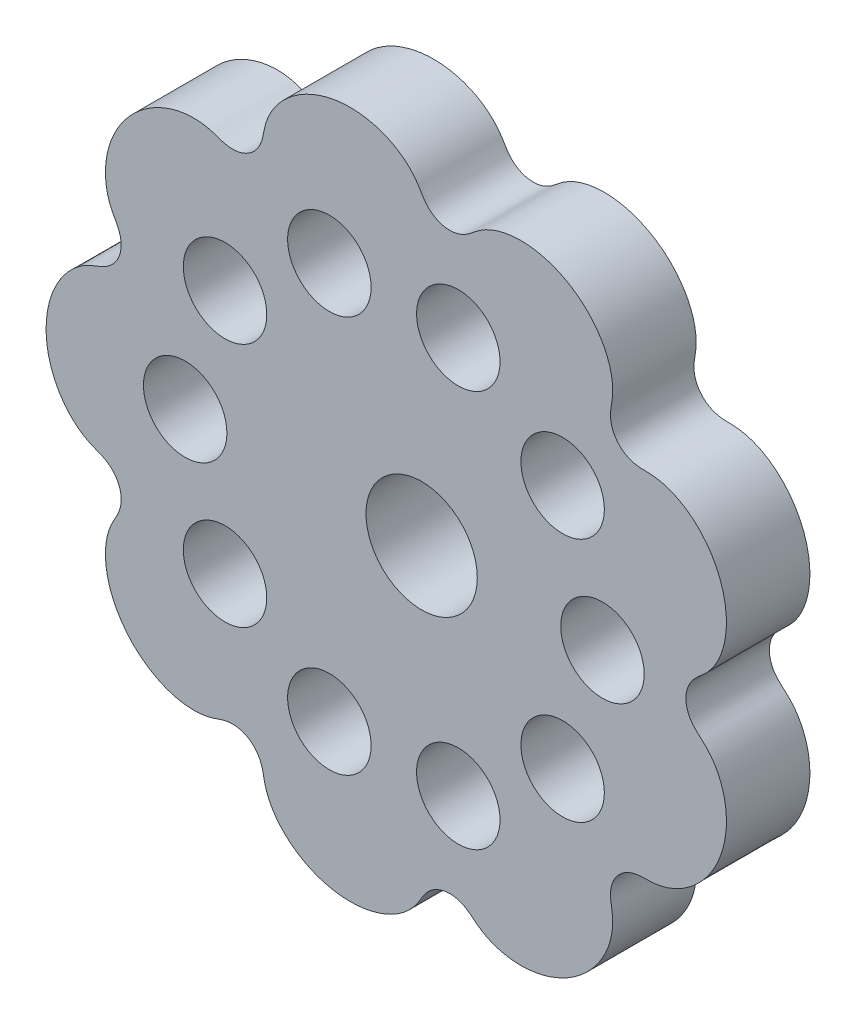
from build123d import *

# Parameters (mm, degrees)
BOSS_EXTRUDE2_DEPTH     = 6
CUT_EXTRUDE1_DEPTH      = 36.670587031
CUT_EXTRUDE1_DEPTH_BACK = 36.670587031
SKETCH6_R               = 4
CUT_EXTRUDE2_DEPTH      = 36.670587031
CUT_EXTRUDE2_DEPTH_BACK = 36.670587031
SKETCH7_R               = 3


with BuildPart() as part:
    # Sketch5 → Boss-Extrude2 (new body)
    with BuildSketch(Plane.XY):
        with BuildLine():
            add(Edge.make_bspline(
                [(21, 0), (21, 0.153716287), (21.031368682, 0.443660206), (21.153926718, 0.826861065), (21.307471228, 1.123621196), (21.458168044, 1.341152827), (21.591257139, 1.499527161), (21.704506257, 1.617762851), (21.800797031, 1.709847827), (21.884182228, 1.785218707), (21.95839232, 1.850124781), (22.026445031, 1.908757729), (22.090651041, 1.964007282), (22.152729406, 2.017933884), (22.213932781, 2.072059386), (22.275153664, 2.127546476), (22.337007477, 2.185310863), (22.399895555, 2.246092552), (22.464052479, 2.310501913), (22.529581703, 2.379049966), (22.596482605, 2.452168597), (22.664671258, 2.53022427), (22.733996607, 2.613527444), (22.80425328, 2.70233915), (22.875191893, 2.796875644), (22.946527489, 2.897311766), (23.01794658, 3.003783415), (23.089113103, 3.116389433), (23.159673571, 3.235193087), (23.229261566, 3.360223299), (23.297501731, 3.491475708), (23.364013359, 3.628913644), (23.428413646, 3.772469067), (23.490320667, 3.92204349), (23.549356123, 4.077508937), (23.605147883, 4.238708933), (23.657332346, 4.405459549), (23.705556639, 4.577550508), (23.749480676, 4.754746359), (23.788779057, 4.936787725), (23.823142854, 5.123392612), (23.852281244, 5.314257798), (23.875923035, 5.509060288), (23.893818051, 5.707458827), (23.905738396, 5.909095486), (23.91147959, 6.113597299), (23.910861585, 6.32057795), (23.903729646, 6.529639508), (23.889955112, 6.740374204), (23.869436024, 6.952366241), (23.842097627, 7.165193627), (23.807892744, 7.378430031), (23.766802021, 7.591646653), (23.718834045, 7.804414097), (23.664025333, 8.016304242), (23.602440191, 8.226892105), (23.534170455, 8.435757687), (23.459335103, 8.642487793), (23.378079742, 8.846677819), (23.290575984, 9.047933508), (23.197020693, 9.245872649), (23.097635128, 9.440126729), (22.992663969, 9.630342523), (22.882374239, 9.816183615), (22.767054117, 9.997331851), (22.647011657, 10.173488706), (22.52257341, 10.344376568), (22.394082954, 10.50973993), (22.261899338, 10.669346484), (22.126395448, 10.822988114), (21.987956291, 10.970481783), (21.846977209, 11.111670303), (21.703862028, 11.246422991), (21.55902114, 11.374636212), (21.412869523, 11.496233783), (21.26582471, 11.611167266), (21.118304697, 11.719416115), (20.970725801, 11.820987698), (20.823500457, 11.915917182), (20.677034967, 12.004267267), (20.531727178, 12.086127792), (20.387964097, 12.161615176), (20.246119415, 12.230871724), (20.106550937, 12.294064768), (19.969597882, 12.351385648), (19.835578028, 12.403048534), (19.70478464, 12.449289064), (19.577483136, 12.49036281), (19.453907389, 12.526543549), (19.334255553, 12.558121334), (19.218685256, 12.58540035), (19.107307931, 12.608696544), (19.000181988, 12.628335033), (18.897304398, 12.64464727), (18.798600094, 12.657968004), (18.703908342, 12.668632096), (18.612964856, 12.676971324), (18.525377888, 12.683311466), (18.440595686, 12.68797026), (18.357861433, 12.691257356), (18.276149883, 12.693478506), (18.194077001, 12.694948305), (18.109769679, 12.696020001), (18.020676933, 12.69714923), (17.923298016, 12.699025392), (17.812802941, 12.70283799), (17.682549757, 12.710809757), (17.523632309, 12.727236362), (17.32501124, 12.760377708), (17.075817946, 12.825299178), (16.772834753, 12.945961355), (16.434148387, 13.150161532), (16.107175074, 13.44950624), (15.848656953, 13.816160834), (15.685840243, 14.191204191), (15.605394373, 14.523741279), (15.576984133, 14.794159555), (15.575265987, 15.006710349), (15.585273878, 15.17424955), (15.59961559, 15.309583491), (15.615028262, 15.422865923), (15.630216798, 15.521548159), (15.64474294, 15.610975853), (15.658500392, 15.694984964), (15.671478728, 15.776354613), (15.683662901, 15.857123307), (15.694994965, 15.938803823), (15.705363699, 16.022528679), (15.714606266, 16.109149285), (15.72251458, 16.199304373), (15.728843092, 16.293467903), (15.733316556, 16.391983175), (15.735637213, 16.495087521), (15.735491214, 16.602930509), (15.732554285, 16.715587628), (15.726496706, 16.833070761), (15.716987677, 16.955336404), (15.703699171, 17.082292226), (15.686309336, 17.213802463), (15.664505523, 17.349692438), (15.637986975, 17.489752447), (15.606467229, 17.633741193), (15.569676268, 17.781388861), (15.527362435, 17.932399953), (15.479294136, 18.086455931), (15.425261358, 18.243217727), (15.36507699, 18.402328141), (15.298577989, 18.56341417), (15.225626365, 18.72608928), (15.146110017, 18.88995562), (15.059943415, 19.054606216), (14.967068127, 19.219627114), (14.867453208, 19.384599507), (14.76109544, 19.549101826), (14.648019439, 19.712711797), (14.528277615, 19.875008471), (14.401950015, 20.035574213), (14.269144018, 20.193996651), (14.129993918, 20.34987058), (13.984660371, 20.502799815), (13.833329733, 20.652398988), (13.676213275, 20.798295284), (13.513546287, 20.940130109), (13.345587081, 21.077560691), (13.172615882, 21.210261595), (12.99493363, 21.337926164), (12.812860687, 21.460267861), (12.626735458, 21.577021531), (12.436912931, 21.687944554), (12.243763148, 21.7928179), (12.047669601, 21.891447079), (11.849027573, 21.983662975), (11.648242422, 22.069322576), (11.44572782, 22.148309571), (11.241903949, 22.220534845), (11.03719567, 22.285936836), (10.832030657, 22.344481778), (10.62683752, 22.396163808), (10.422043914, 22.441004952), (10.218074647, 22.479054977), (10.015349781, 22.510391113), (9.814282756, 22.53511765), (9.615278519, 22.553365386), (9.418731679, 22.565290967), (9.225024692, 22.571076068), (9.034526076, 22.570926463), (8.847588665, 22.565070944), (8.664547904, 22.553760111), (8.48572019, 22.537265029), (8.311401257, 22.515875734), (8.14186461, 22.489899605), (7.977360004, 22.459659579), (7.818111962, 22.425492218), (7.664318328, 22.387745593), (7.516148849, 22.346777007), (7.373743756, 22.302950497), (7.237212344, 22.256634119), (7.106631495, 22.208196971), (6.98204413, 22.15800591), (6.8634575, 22.106421889), (6.750841268, 22.053795861), (6.644125244, 22.000464112), (6.543196637, 21.946742896), (6.447896581, 21.892922167), (6.358015659, 21.839258151), (6.273287925, 21.785964407), (6.193382808, 21.733200874), (6.117893894, 21.681060281), (6.04632311, 21.629551), (5.978058059, 21.578575182), (5.912338981, 21.52790057), (5.848209766, 21.477124044), (5.784444076, 21.425624598), (5.719432019, 21.37250387), (5.651003607, 21.316514657), (5.576150569, 21.2559859), (5.490587051, 21.188775678), (5.388068997, 21.112344956), (5.25941126, 21.024195837), (5.091353567, 20.923244125), (4.866266554, 20.813180263), (4.565790839, 20.708632471), (4.183392496, 20.640754922), (3.743664709, 20.649470037), (3.305580683, 20.75419156), (2.930351837, 20.931613487), (2.645031729, 21.134494647), (2.441632936, 21.325944641), (2.29836216, 21.490825669), (2.194914722, 21.628382912), (2.116761135, 21.743416963), (2.054417639, 21.841643819), (2.001812156, 21.928053209), (1.954995439, 22.006573716), (1.9113121, 22.080170839), (1.868900646, 22.151040507), (1.826396557, 22.220790386), (1.782755082, 22.290584135), (1.737144061, 22.361249751), (1.688878057, 22.433359287), (1.637377189, 22.507287326), (1.582141037, 22.583254109), (1.522731872, 22.661357656), (1.458763779, 22.741598027), (1.389895548, 22.823895922), (1.315826016, 22.908107177), (1.236290991, 22.994034277), (1.15106124, 23.081435656), (1.059941153, 23.170033361), (0.96276785, 23.259519482), (0.85941057, 23.349561652), (0.749770218, 23.439807823), (0.633779, 23.529890493), (0.511400083, 23.619430487), (0.38262725, 23.708040394), (0.24748451, 23.795327717), (0.106025655, 23.880897789), (-0.041666263, 23.964356487), (-0.195479525, 24.045312778), (-0.35527444, 24.123381111), (-0.520884118, 24.198183666), (-0.692115348, 24.269352481), (-0.868749561, 24.336531457), (-1.05054389, 24.399378238), (-1.237232315, 24.457565985), (-1.428526904, 24.510785036), (-1.624119131, 24.558744443), (-1.823681269, 24.601173411), (-2.026867869, 24.637822606), (-2.233317296, 24.668465356), (-2.442653336, 24.692898736), (-2.654486851, 24.710944525), (-2.868417498, 24.722450045), (-3.084035474, 24.727288886), (-3.300923311, 24.72536149), (-3.518657695, 24.716595627), (-3.736811308, 24.700946733), (-3.95495468, 24.678398129), (-4.172658057, 24.648961107), (-4.389493257, 24.612674895), (-4.605035529, 24.569606496), (-4.818865388, 24.519850394), (-5.030570426, 24.463528145), (-5.2397471, 24.400787843), (-5.446002474, 24.331803464), (-5.648955916, 24.256774091), (-5.848240744, 24.17592303), (-6.043505815, 24.089496803), (-6.23441704, 23.997764043), (-6.420658832, 23.90101427), (-6.601935472, 23.799556582), (-6.77797239, 23.693718227), (-6.948517358, 23.583843094), (-7.113341577, 23.470290112), (-7.272240679, 23.35343155), (-7.425035601, 23.233651248), (-7.571573369, 23.111342754), (-7.711727756, 22.986907391), (-7.845399817, 22.860752237), (-7.972518317, 22.73328804), (-8.093040018, 22.604927046), (-8.206949848, 22.476080752), (-8.314260935, 22.347157574), (-8.41501451, 22.218560417), (-8.509279677, 22.090684147), (-8.597153043, 21.963912943), (-8.678758218, 21.838617489), (-8.754245179, 21.71515201), (-8.82378949, 21.593851065), (-8.887591403, 21.47502607), (-8.945874819, 21.35896145), (-8.998886142, 21.24591032), (-9.046893021, 21.136089542), (-9.090183018, 21.029673948), (-9.129062231, 20.926789461), (-9.163853953, 20.827504714), (-9.194897468, 20.731820635), (-9.222547166, 20.639657222), (-9.247172303, 20.550836438), (-9.269157921, 20.465059643), (-9.288907836, 20.381877312), (-9.306851289, 20.300647705), (-9.323456058, 20.220479606), (-9.339253084, 20.140151966), (-9.354881881, 20.058000027), (-9.371173973, 19.971753491), (-9.389306865, 19.878308702), (-9.411089931, 19.773419482), (-9.439495655, 19.651319552), (-9.479629848, 19.504401238), (-9.540394127, 19.323420238), (-9.636839385, 19.099539117), (-9.791679595, 18.830738114), (-10.030488158, 18.533817715), (-10.363405113, 18.252591075), (-10.762426903, 18.041040832), (-11.167126142, 17.925433864), (-11.523423228, 17.890508076), (-11.810032821, 17.903044773), (-12.032077958, 17.936091667), (-12.204330138, 17.974837703), (-12.341300405, 18.012964498), (-12.454305329, 18.048459735), (-12.551509613, 18.081130753), (-12.638682491, 18.111417454), (-12.719914708, 18.139886134), (-12.798146754, 18.16703517), (-12.875528599, 18.193234274), (-12.953658859, 18.218717734), (-13.03374354, 18.243597415), (-13.116702301, 18.267881314), (-13.203240546, 18.291492064), (-13.293899107, 18.314283449), (-13.389089051, 18.336054503), (-13.489116493, 18.35656134), (-13.594200607, 18.375527022), (-13.704486946, 18.392649831), (-13.820057481, 18.407610239), (-13.940938344, 18.420076839), (-14.06710592, 18.42971144), (-14.198491777, 18.436173488), (-14.334986747, 18.439123937), (-14.476444394, 18.438228664), (-14.622684056, 18.433161511), (-14.773493564, 18.423606998), (-14.928631733, 18.409262755), (-15.087830704, 18.389841722), (-15.250798167, 18.365074107), (-15.41721951, 18.334709167), (-15.586759918, 18.29851678), (-15.759066441, 18.256288861), (-15.933770038, 18.207840602), (-16.110487617, 18.153011556), (-16.288824058, 18.091666565), (-16.468374239, 18.023696544), (-16.648725052, 17.949019115), (-16.829457421, 17.867579093), (-17.010148301, 17.779348843), (-17.190372672, 17.684328488), (-17.369705515, 17.582545988), (-17.547723763, 17.474057078), (-17.724008232, 17.358945088), (-17.898145511, 17.237320616), (-18.06972982, 17.109321096), (-18.238364816, 16.975110227), (-18.403665357, 16.834877292), (-18.565259202, 16.68883636), (-18.722788646, 16.537225376), (-18.875912092, 16.380305148), (-19.024305543, 16.218358225), (-19.167664015, 16.051687684), (-19.305702857, 15.880615827), (-19.438158991, 15.705482781), (-19.564792042, 15.52664503), (-19.685385372, 15.344473867), (-19.799747012, 15.159353776), (-19.907710473, 14.971680758), (-20.00913545, 14.781860592), (-20.103908408, 14.590307061), (-20.191943044, 14.397440124), (-20.273180628, 14.203684061), (-20.347590212, 14.009465582), (-20.415168721, 13.815211926), (-20.475940901, 13.621348932), (-20.529959142, 13.428299111), (-20.577303166, 13.23647971), (-20.618079579, 13.046300783), (-20.652421284, 12.858163267), (-20.680486758, 12.672457072), (-20.702459186, 12.489559191), (-20.718545455, 12.309831822), (-20.728975004, 12.13362052), (-20.733998518, 11.961252362), (-20.733886474, 11.793034141), (-20.728927528, 11.62925056), (-20.719426727, 11.470162451), (-20.705703549, 11.316004975), (-20.688089737, 11.166985806), (-20.666926926, 11.023283273), (-20.642564023, 10.885044412), (-20.61535431, 10.752382906), (-20.58565222, 10.625376822), (-20.553809722, 10.504066082), (-20.520172247, 10.388449538), (-20.485074021, 10.278481476), (-20.448832684, 10.17406734), (-20.41174299, 10.07505832), (-20.374069336, 9.981244368), (-20.336036783, 9.892344934), (-20.297820121, 9.807996463), (-20.259530396, 9.727735159), (-20.221198151, 9.65097282), (-20.182752482, 9.57696233), (-20.14399491, 9.504747552), (-20.104567272, 9.433089288), (-20.063913842, 9.360354117), (-20.021241006, 9.284345027), (-19.975486273, 9.202040784), (-19.925329954, 9.109194731), (-19.869335507, 8.999730289), (-19.806426658, 8.864895171), (-19.737159913, 8.692327482), (-19.666605361, 8.465902195), (-19.609434895, 8.169016031), (-19.594517415, 7.795804774), (-19.658288016, 7.369256262), (-19.818068466, 6.946185494), (-20.048922238, 6.587793182), (-20.300083404, 6.321819453), (-20.531297259, 6.139321359), (-20.726752341, 6.016699566), (-20.88712978, 5.932435045), (-21.019229984, 5.87164714), (-21.13051072, 5.8250269), (-21.227263677, 5.78687905), (-21.314341753, 5.753657569), (-21.395362333, 5.723065327), (-21.472988325, 5.693534212), (-21.549170977, 5.663929423), (-21.625334897, 5.633380468), (-21.702512825, 5.601183409), (-21.781442474, 5.566743511), (-21.862636133, 5.529541176), (-21.946431079, 5.489111544), (-22.03302653, 5.445032238), (-22.12251112, 5.396916058), (-22.214883658, 5.344406716), (-22.310069083, 5.287176445), (-22.407930968, 5.224924787), (-22.508281486, 5.157378102), (-22.610889532, 5.084289518), (-22.715487473, 5.005439127), (-22.821776851, 4.92063432), (-22.929433323, 4.829710171), (-23.038110989, 4.732529816), (-23.147446273, 4.62898479), (-23.25706143, 4.518995296), (-23.366567773, 4.402510395), (-23.475568671, 4.279508093), (-23.583662346, 4.149995326), (-23.690444517, 4.014007839), (-23.795510905, 3.871609947), (-23.898459611, 3.722894183), (-23.998893383, 3.567980836), (-24.096421777, 3.407017368), (-24.190663226, 3.240177727), (-24.281246998, 3.067661547), (-24.367815066, 2.889693241), (-24.450023881, 2.70652099), (-24.527546047, 2.518415642), (-24.600071887, 2.325669505), (-24.667310924, 2.128595059), (-24.72899324, 1.927523583), (-24.784870739, 1.722803703), (-24.834718297, 1.514799868), (-24.878334796, 1.303890762), (-24.915544046, 1.090467653), (-24.946195592, 0.874932698), (-24.970165392, 0.657697196), (-24.987356384, 0.439179804), (-24.997698924, 0.219804725), (-25.001151098, -1.26e-07), (-24.997698916, -0.219804976), (-24.987356368, -0.439180054), (-24.970165368, -0.657697445), (-24.94619556, -0.874932945), (-24.915544007, -1.090467898), (-24.878334749, -1.303891004), (-24.834718243, -1.514800108), (-24.784870678, -1.722803939), (-24.728993172, -1.927523815), (-24.66731085, -2.128595286), (-24.600071807, -2.325669727), (-24.527545961, -2.51841586), (-24.45002379, -2.706521202), (-24.367814969, -2.889693447), (-24.281246897, -3.067661748), (-24.190663121, -3.240177921), (-24.096421668, -3.407017555), (-23.998893269, -3.567981016), (-23.898459495, -3.722894357), (-23.795510786, -3.871610113), (-23.690444396, -4.014007998), (-23.583662223, -4.149995477), (-23.475568547, -4.279508237), (-23.366567648, -4.402510532), (-23.257061304, -4.518995426), (-23.147446148, -4.628984912), (-23.038110865, -4.732529931), (-22.929433199, -4.829710278), (-22.821776729, -4.92063442), (-22.715487353, -5.00543922), (-22.610889414, -5.084289605), (-22.50828137, -5.157378183), (-22.407930855, -5.224924861), (-22.310068973, -5.287176513), (-22.21488355, -5.344406779), (-22.122511016, -5.396916116), (-22.033026429, -5.44503229), (-21.946430982, -5.489111592), (-21.862636039, -5.529541221), (-21.781442383, -5.566743552), (-21.702512736, -5.601183447), (-21.625334809, -5.633380503), (-21.54917089, -5.663929457), (-21.472988237, -5.693534246), (-21.395362243, -5.723065361), (-21.314341657, -5.753657606), (-21.227263573, -5.786879091), (-21.130510603, -5.825026948), (-21.019229846, -5.8716472), (-20.887129615, -5.932435126), (-20.726752139, -6.016699681), (-20.531297014, -6.139321529), (-20.300083123, -6.321819705), (-20.048921952, -6.58779354), (-19.818068234, -6.94618595), (-19.658287888, -7.36925676), (-19.594517393, -7.795805239), (-19.609434943, -8.169016415), (-19.666605438, -8.465902491), (-19.737159994, -8.692327707), (-19.806426734, -8.864895344), (-19.869335575, -8.999730427), (-19.925330015, -9.109194846), (-19.975486328, -9.202040883), (-20.021241056, -9.284345116), (-20.06391389, -9.360354202), (-20.104567318, -9.43308937), (-20.143994955, -9.504747634), (-20.182752526, -9.576962414), (-20.221198195, -9.650972906), (-20.25953044, -9.727735248), (-20.297820165, -9.807996557), (-20.336036827, -9.892345033), (-20.37406938, -9.981244472), (-20.411743033, -10.07505843), (-20.448832726, -10.174067456), (-20.485074062, -10.278481599), (-20.520172286, -10.388449667), (-20.55380976, -10.504066218), (-20.585652255, -10.625376964), (-20.615354343, -10.752383054), (-20.642564052, -10.885044567), (-20.666926952, -11.023283434), (-20.688089759, -11.166985973), (-20.705703567, -11.316005148), (-20.719426741, -11.47016263), (-20.728927536, -11.629250745), (-20.733886477, -11.79303433), (-20.733998515, -11.961252557), (-20.728974996, -12.133620719), (-20.71854544, -12.309832025), (-20.702459164, -12.489559398), (-20.680486729, -12.672457283), (-20.652421249, -12.85816348), (-20.618079536, -13.046300999), (-20.577303116, -13.236479928), (-20.529959084, -13.428299331), (-20.475940835, -13.621349153), (-20.415168648, -13.815212148), (-20.347590131, -14.009465804), (-20.273180539, -14.203684282), (-20.191942947, -14.397440345), (-20.103908303, -14.590307281), (-20.009135338, -14.78186081), (-19.907710353, -14.971680973), (-19.799746885, -15.159353989), (-19.685385238, -15.344474077), (-19.5647919, -15.526645236), (-19.438158843, -15.705482983), (-19.305702703, -15.880616025), (-19.167663854, -16.051687877), (-19.024305377, -16.218358412), (-18.87591192, -16.38030533), (-18.722788468, -16.537225552), (-18.56525902, -16.68883653), (-18.403665171, -16.834877456), (-18.238364625, -16.975110384), (-18.069729625, -17.109321246), (-17.898145314, -17.237320759), (-17.724008032, -17.358945223), (-17.547723561, -17.474057206), (-17.369705311, -17.582546108), (-17.190372467, -17.684328601), (-17.010148095, -17.779348948), (-16.829457215, -17.86757919), (-16.648724846, -17.949019204), (-16.468374033, -18.023696626), (-16.288823854, -18.091666639), (-16.110487414, -18.153011622), (-15.933769837, -18.207840661), (-15.759066242, -18.256288913), (-15.586759723, -18.298516825), (-15.417219318, -18.334709205), (-15.250797979, -18.365074139), (-15.08783052, -18.389841747), (-14.928631553, -18.409262774), (-14.773493389, -18.423607011), (-14.622683887, -18.43316152), (-14.476444229, -18.438228667), (-14.334986588, -18.439123935), (-14.198491624, -18.436173483), (-14.067105773, -18.429711431), (-13.940938202, -18.420076826), (-13.820057346, -18.407610224), (-13.704486817, -18.392649813), (-13.594200484, -18.375527002), (-13.489116376, -18.356561317), (-13.38908894, -18.336054479), (-13.293899001, -18.314283423), (-13.203240445, -18.291492038), (-13.116702204, -18.267881287), (-13.033743447, -18.243597387), (-12.953658769, -18.218717705), (-12.87552851, -18.193234244), (-12.798146665, -18.167035139), (-12.719914617, -18.139886103), (-12.638682395, -18.111417421), (-12.551509509, -18.081130717), (-12.45430521, -18.048459696), (-12.341300264, -18.012964456), (-12.204329964, -17.974837658), (-12.032077735, -17.936091624), (-11.810032533, -17.903044743), (-11.52342286, -17.890508082), (-11.1671257, -17.925433944), (-10.762426431, -18.041041019), (-10.363404685, -18.252591366), (-10.03048783, -18.533818056), (-9.791679374, -18.830738443), (-9.636839246, -19.099539399), (-9.54039404, -19.323420468), (-9.479629793, -19.504401424), (-9.439495617, -19.651319704), (-9.411089903, -19.77341961), (-9.389306843, -19.878308814), (-9.371173954, -19.971753593), (-9.354881863, -20.058000122), (-9.339253066, -20.140152058), (-9.323456039, -20.220479698), (-9.306851269, -20.300647797), (-9.288907814, -20.381877406), (-9.269157897, -20.465059739), (-9.247172277, -20.550836538), (-9.222547136, -20.639657325), (-9.194897434, -20.731820742), (-9.163853916, -20.827504826), (-9.129062189, -20.926789577), (-9.090182971, -21.029674068), (-9.046892969, -21.136089666), (-8.998886084, -21.245910448), (-8.945874755, -21.358961581), (-8.887591333, -21.475026204), (-8.823789414, -21.593851202), (-8.754245096, -21.71515215), (-8.678758129, -21.838617631), (-8.597152946, -21.963913087), (-8.509279573, -22.090684293), (-8.415014399, -22.218560563), (-8.314260816, -22.347157721), (-8.206949722, -22.4760809), (-8.093039884, -22.604927193), (-7.972518175, -22.733288186), (-7.845399668, -22.860752382), (-7.711727599, -22.986907534), (-7.571573206, -23.111342895), (-7.42503543, -23.233651386), (-7.2722405, -23.353431685), (-7.113341392, -23.470290243), (-6.948517166, -23.583843222), (-6.777972192, -23.69371835), (-6.601935267, -23.799556701), (-6.420658622, -23.901014384), (-6.234416825, -23.99776415), (-6.043505594, -24.089496905), (-5.848240519, -24.175923126), (-5.648955686, -24.256774181), (-5.44600224, -24.331803546), (-5.239746863, -24.400787918), (-5.030570185, -24.463528213), (-4.818865144, -24.519850455), (-4.605035284, -24.569606549), (-4.38949301, -24.612674941), (-4.172657808, -24.648961144), (-3.954954431, -24.678398158), (-3.736811059, -24.700946755), (-3.518657446, -24.716595641), (-3.300923062, -24.725361496), (-3.084035227, -24.727288884), (-2.868417252, -24.722450036), (-2.654486608, -24.710944508), (-2.442653095, -24.692898712), (-2.233317059, -24.668465325), (-2.026867635, -24.637822567), (-1.823681039, -24.601173366), (-1.624118905, -24.558744392), (-1.428526683, -24.510784978), (-1.237232099, -24.457565922), (-1.050543679, -24.399378168), (-0.868749357, -24.336531383), (-0.69211515, -24.269352402), (-0.520883926, -24.198183582), (-0.355274254, -24.123381024), (-0.195479346, -24.045312688), (-0.04166609, -23.964356393), (0.10602582, -23.880897692), (0.247484668, -23.795327619), (0.382627401, -23.708040294), (0.511400226, -23.619430385), (0.633779136, -23.52989039), (0.749770347, -23.43980772), (0.859410692, -23.349561549), (0.962767965, -23.259519379), (1.05994126, -23.170033259), (1.151061341, -23.081435556), (1.236291085, -22.994034178), (1.315826103, -22.90810708), (1.38989563, -22.823895827), (1.458763854, -22.741597934), (1.522731942, -22.661357566), (1.582141102, -22.583254021), (1.63737725, -22.507287241), (1.688878113, -22.433359203), (1.737144115, -22.36124967), (1.782755133, -22.290584055), (1.826396607, -22.220790306), (1.868900694, -22.151040427), (1.911312149, -22.080170757), (1.954995491, -22.006573629), (2.001812212, -21.928053115), (2.054417704, -21.841643714), (2.116761214, -21.743416842), (2.194914823, -21.628382769), (2.298362298, -21.490825497), (2.44163313, -21.325944436), (2.645032004, -21.134494416), (2.930352216, -20.93161326), (3.305581157, -20.75419139), (3.743665224, -20.649469972), (4.183392974, -20.640754963), (4.56579123, -20.708632577), (4.866266851, -20.81318039), (5.091353788, -20.923244247), (5.259411427, -21.024195945), (5.388069127, -21.112345049), (5.490587157, -21.18877576), (5.57615066, -21.255985973), (5.651003688, -21.316514723), (5.719432095, -21.372503932), (5.784444149, -21.425624658), (5.848209839, -21.477124102), (5.912339055, -21.527900628), (5.978058136, -21.57857524), (6.04632319, -21.629551059), (6.117893978, -21.68106034), (6.193382897, -21.733200934), (6.273288019, -21.785964468), (6.358015759, -21.839258213), (6.447896687, -21.892922228), (6.543196749, -21.946742958), (6.644125363, -22.000464173), (6.750841393, -22.053795921), (6.863457632, -22.106421948), (6.982044269, -22.158005968), (7.106631641, -22.208197028), (7.237212496, -22.256634173), (7.373743916, -22.302950548), (7.516149015, -22.346777056), (7.664318501, -22.387745638), (7.818112141, -22.425492259), (7.977360189, -22.459659616), (8.141864801, -22.489899637), (8.311401453, -22.515875761), (8.485720392, -22.537265051), (8.664548111, -22.553760127), (8.847588877, -22.565070954), (9.034526292, -22.570926467), (9.225024912, -22.571076065), (9.418731902, -22.565290957), (9.615278745, -22.553365369), (9.814282985, -22.535117625), (10.015350012, -22.510391081), (10.218074879, -22.479054937), (10.422044148, -22.441004905), (10.626837754, -22.396163753), (10.832030891, -22.344481715), (11.037195905, -22.285936766), (11.241904183, -22.220534766), (11.445728052, -22.148309484), (11.648242652, -22.069322481), (11.849027801, -21.983662874), (12.047669827, -21.89144697), (12.243763371, -21.792817784), (12.43691315, -21.687944431), (12.626735673, -21.577021401), (12.812860897, -21.460267725), (12.994933836, -21.337926021), (13.172616083, -21.210261447), (13.345587276, -21.077560537), (13.513546476, -20.940129949), (13.676213457, -20.798295119), (13.833329909, -20.652398819), (13.98466054, -20.502799643), (14.12999408, -20.349870404), (14.269144174, -20.193996471), (14.401950163, -20.03557403), (14.528277756, -19.875008286), (14.648019572, -19.712711611), (14.761095566, -19.549101639), (14.867453325, -19.384599319), (14.967068237, -19.219626925), (15.059943517, -19.054606027), (15.146110112, -18.889955432), (15.225626452, -18.726089093), (15.298578069, -18.563413985), (15.365077063, -18.402327958), (15.425261423, -18.243217547), (15.479294194, -18.086455754), (15.527362486, -17.932399778), (15.569676313, -17.78138869), (15.606467268, -17.633741026), (15.637987008, -17.489752285), (15.664505551, -17.34969228), (15.686309359, -17.21380231), (15.703699188, -17.082292078), (15.71698769, -16.955336261), (15.726496715, -16.833070624), (15.73255429, -16.715587496), (15.735491215, -16.602930383), (15.735637212, -16.4950874), (15.733316552, -16.39198306), (15.728843086, -16.293467793), (15.722514572, -16.199304268), (15.714606256, -16.109149184), (15.705363687, -16.022528581), (15.694994952, -15.938803729), (15.683662888, -15.857123214), (15.671478713, -15.776354521), (15.658500376, -15.69498487), (15.644742923, -15.610975755), (15.630216781, -15.521548053), (15.615028244, -15.422865803), (15.599615573, -15.309583351), (15.585273863, -15.174249379), (15.57526598, -15.006710135), (15.576984146, -14.794159281), (15.605394429, -14.523740933), (15.685840377, -14.19120378), (15.848657195, -13.816160398), (16.107175418, -13.44950585), (16.434148779, -13.150161244), (16.772835126, -12.945961174), (17.075818263, -12.825299077), (17.325011494, -12.760377655), (17.523632511, -12.727236336), (17.682549921, -12.710809744), (17.812803077, -12.702837984), (17.923298133, -12.699025389), (18.020677039, -12.697149228), (18.109769778, -12.696019999), (18.194077095, -12.694948304), (18.276149976, -12.693478504), (18.357861526, -12.691257353), (18.440595782, -12.687970256), (18.525377987, -12.68331146), (18.612964957, -12.676971315), (18.703908448, -12.668632085), (18.798600205, -12.65796799), (18.897304513, -12.644647253), (19.000182108, -12.628335013), (19.107308056, -12.60869652), (19.218685386, -12.585400321), (19.334255687, -12.558121301), (19.453907528, -12.526543511), (19.57748328, -12.490362766), (19.704784788, -12.449289014), (19.83557818, -12.403048478), (19.969598037, -12.351385586), (20.106551095, -12.294064699), (20.246119576, -12.230871648), (20.387964261, -12.161615093), (20.531727344, -12.086127702), (20.677035134, -12.00426717), (20.823500625, -11.915917077), (20.970725969, -11.820987586), (21.118304866, -11.719415995), (21.265824878, -11.611167138), (21.41286969, -11.496233648), (21.559021306, -11.374636069), (21.703862193, -11.246422841), (21.846977371, -11.111670145), (21.987956451, -10.970481618), (22.126395605, -10.822987942), (22.261899491, -10.669346305), (22.394083103, -10.509739744), (22.522573554, -10.344376376), (22.647011796, -10.173488508), (22.767054251, -9.997331647), (22.882374368, -9.816183405), (22.992664092, -9.630342308), (23.097635244, -9.44012651), (23.197020803, -9.245872425), (23.290576087, -9.04793328), (23.378079839, -8.846677587), (23.459335192, -8.642487558), (23.534170537, -8.43575745), (23.602440265, -8.226891866), (23.664025399, -8.016304001), (23.718834104, -7.804413854), (23.766802072, -7.591646409), (23.807892787, -7.378429787), (23.842097662, -7.165193383), (23.869436052, -6.952365998), (23.889955132, -6.740373962), (23.903729658, -6.529639268), (23.910861589, -6.320577712), (23.911479587, -6.113597064), (23.905738386, -5.909095254), (23.893818034, -5.707458598), (23.875923012, -5.509060063), (23.852281214, -5.314257578), (23.823142817, -5.123392396), (23.788779015, -4.936787514), (23.749480628, -4.754746154), (23.705556587, -4.577550308), (23.657332288, -4.405459355), (23.605147822, -4.238708746), (23.549356058, -4.077508756), (23.490320598, -3.922043315), (23.428413574, -3.772468899), (23.364013284, -3.628913484), (23.297501653, -3.491475554), (23.229261487, -3.360223153), (23.159673491, -3.235192948), (23.089113022, -3.116389301), (23.017946498, -3.00378329), (22.946527408, -2.897311648), (22.875191811, -2.796875533), (22.804253199, -2.702339045), (22.733996527, -2.613527346), (22.664671179, -2.530224178), (22.596482528, -2.452168511), (22.529581627, -2.379049885), (22.464052405, -2.310501837), (22.399895483, -2.24609248), (22.337007406, -2.185310795), (22.275153594, -2.127546411), (22.213932712, -2.072059323), (22.152729336, -2.017933822), (22.090650969, -1.964007219), (22.026444956, -1.908757665), (21.958392239, -1.850124711), (21.884182138, -1.785218628), (21.800796929, -1.709847733), (21.704506138, -1.617762733), (21.591256998, -1.499527006), (21.458167881, -1.341152616), (21.30747105, -1.123620906), (21.153926552, -0.826860675), (21.031368632, -0.443659894), (21, -0.153716119), (21, 0)],
                knots=[0, 0, 0, 0, 0.002694077, 0.005081644, 0.007023646, 0.008540536, 0.009719768, 0.010652956, 0.011414362, 0.012059055, 0.012626683, 0.01314567, 0.013636522, 0.014114192, 0.014589709, 0.015071292, 0.015565123, 0.016075878, 0.016607107, 0.017161501, 0.017741087, 0.018347375, 0.018981459, 0.019644102, 0.020335798, 0.021056812, 0.021807228, 0.022586967, 0.023395821, 0.024233463, 0.025099465, 0.025993314, 0.026914418, 0.027862115, 0.028835683, 0.029834345, 0.030857271, 0.03190359, 0.032972386, 0.034062708, 0.035173569, 0.036303951, 0.037452808, 0.038619067, 0.03980163, 0.04099938, 0.042211177, 0.043435864, 0.044672267, 0.0459192, 0.047175461, 0.048439838, 0.049711111, 0.050988048, 0.052269413, 0.053553965, 0.054840459, 0.056127646, 0.057414278, 0.058699107, 0.059980888, 0.061258379, 0.062530341, 0.063795545, 0.065052768, 0.066300797, 0.067538429, 0.068764476, 0.069977762, 0.071177129, 0.072361436, 0.073529561, 0.074680405, 0.075812892, 0.076925973, 0.078018626, 0.079089861, 0.080138723, 0.081164293, 0.082165692, 0.083142088, 0.084092696, 0.085016788, 0.085913696, 0.08678282, 0.087623635, 0.088435706, 0.089218693, 0.089972373, 0.090696653, 0.091391596, 0.092057448, 0.092694673, 0.093304002, 0.093886489, 0.094443592, 0.094977275, 0.095490148, 0.095985652, 0.096468322, 0.09694415, 0.097421096, 0.097909828, 0.098424795, 0.098985785, 0.099620196, 0.100366236, 0.101277041, 0.102424651, 0.103899273, 0.10579101, 0.108132339, 0.110805317, 0.1135165, 0.11594862, 0.117941251, 0.119501554, 0.120713558, 0.121670045, 0.122447494, 0.123102953, 0.123677567, 0.124200825, 0.124693979, 0.125172509, 0.125647816, 0.126128388, 0.126620603, 0.127129284, 0.127658092, 0.128209801, 0.128786505, 0.129389765, 0.130020717, 0.130680159, 0.131368609, 0.132086359, 0.132833508, 0.133609998, 0.134415631, 0.135250093, 0.136112968, 0.137003751, 0.137921858, 0.138866635, 0.139837366, 0.140833279, 0.141853552, 0.142897316, 0.143963661, 0.145051639, 0.146160268, 0.147288532, 0.148435389, 0.149599768, 0.150780575, 0.151976693, 0.153186986, 0.154410298, 0.155645458, 0.15689128, 0.158146564, 0.1594101, 0.160680667, 0.161957035, 0.16323797, 0.16452223, 0.165808569, 0.16709574, 0.168382496, 0.169667587, 0.170949768, 0.172227797, 0.173500434, 0.17476645, 0.176024619, 0.177273729, 0.178512576, 0.179739968, 0.18095473, 0.1821557, 0.183341736, 0.184511714, 0.185664531, 0.18679911, 0.187914398, 0.189009371, 0.190083034, 0.191134428, 0.19216263, 0.193166756, 0.19414597, 0.195099481, 0.196026553, 0.196926513, 0.197798751, 0.198642735, 0.199458017, 0.20024425, 0.201001193, 0.20172874, 0.202426934, 0.203096, 0.203736375, 0.204348758, 0.204934163, 0.205494, 0.20603017, 0.206545202, 0.207042434, 0.207526265, 0.208002501, 0.208478854, 0.208965644, 0.209476833, 0.210031519, 0.210656116, 0.21138744, 0.212276751, 0.213393867, 0.214827389, 0.21666937, 0.218963054, 0.221611133, 0.224335285, 0.226809986, 0.228853448, 0.230458269, 0.231704212, 0.232684945, 0.233479135, 0.234145865, 0.234727826, 0.235255614, 0.235751261, 0.236230789, 0.236705989, 0.237185628, 0.237676287, 0.23818294, 0.23870936, 0.23925841, 0.239832251, 0.240432497, 0.241060327, 0.241716573, 0.242401782, 0.243116268, 0.243860151, 0.244633388, 0.245435797, 0.246267075, 0.247126816, 0.248014526, 0.248929628, 0.249871476, 0.25083936, 0.251832515, 0.252850123, 0.253891321, 0.254955203, 0.256040826, 0.257147209, 0.258273343, 0.259418186, 0.260580672, 0.261759708, 0.262954181, 0.264162956, 0.265384879, 0.266618781, 0.267863477, 0.269117769, 0.270380448, 0.271650295, 0.272926079, 0.274206568, 0.27549052, 0.276776689, 0.27806383, 0.279350693, 0.280636031, 0.281918597, 0.283197148, 0.284470445, 0.285737257, 0.286996359, 0.288246535, 0.289486581, 0.290715305, 0.291931527, 0.293134087, 0.294321838, 0.295493655, 0.296648433, 0.297785091, 0.298902573, 0.299999853, 0.301075931, 0.302129846, 0.303160669, 0.304167513, 0.305149535, 0.306105939, 0.307035983, 0.307938987, 0.308814332, 0.309661479, 0.310479971, 0.311269444, 0.31202965, 0.312760464, 0.313461912, 0.314134197, 0.314777731, 0.31539318, 0.315981521, 0.316544115, 0.317082803, 0.317600035, 0.31809905, 0.318584113, 0.319060852, 0.319536737, 0.320021756, 0.3205294, 0.321078106, 0.321693339, 0.322410576, 0.323279252, 0.324366981, 0.32576059, 0.327553453, 0.32979836, 0.332417948, 0.335150813, 0.337665835, 0.339760146, 0.341410546, 0.34269161, 0.343697562, 0.34450922, 0.345187743, 0.345777425, 0.346310013, 0.346808347, 0.347289019, 0.34776422, 0.348243007, 0.34873217, 0.34923684, 0.349760908, 0.350307325, 0.350878323, 0.35147557, 0.352100289, 0.352753346, 0.353435317, 0.354146541, 0.354887157, 0.355657139, 0.356456319, 0.357284408, 0.358141009, 0.359025639, 0.359937728, 0.360876638, 0.361841666, 0.362832052, 0.363846985, 0.364885606, 0.365947014, 0.367030268, 0.368134395, 0.369258385, 0.370401201, 0.37156178, 0.372739032, 0.373931846, 0.375139088, 0.376359607, 0.377592237, 0.378835792, 0.380089078, 0.381350885, 0.382619996, 0.383895182, 0.385175209, 0.386458837, 0.387744822, 0.389031916, 0.390318872, 0.391604441, 0.392887376, 0.394166435, 0.395440377, 0.39670797, 0.397967988, 0.399219216, 0.400460447, 0.401690487, 0.402908156, 0.40411229, 0.405301743, 0.406475385, 0.40763211, 0.408770834, 0.409890499, 0.410990073, 0.412068555, 0.413124979, 0.414158412, 0.415167963, 0.416152783, 0.417112071, 0.418045079, 0.418951119, 0.419829566, 0.420679871, 0.421501565, 0.422294278, 0.423057744, 0.423791826, 0.42449653, 0.425172039, 0.42581874, 0.426437267, 0.427028561, 0.427593935, 0.42813517, 0.428654643, 0.429155493, 0.429641856, 0.43011919, 0.43059473, 0.431078142, 0.431582468, 0.432125504, 0.432731807, 0.433435562, 0.434284437, 0.43534386, 0.436698753, 0.438443251, 0.440638508, 0.44322625, 0.445963491, 0.448516287, 0.450661268, 0.45235825, 0.453675629, 0.454707801, 0.455537679, 0.456228536, 0.456826327, 0.457363994, 0.45786522, 0.458347184, 0.458822498, 0.459300515, 0.459788246, 0.460290981, 0.460812733, 0.461356545, 0.46192472, 0.462518983, 0.4631406, 0.463790475, 0.464469213, 0.465177176, 0.465914525, 0.466681251, 0.467477199, 0.468302093, 0.469155549, 0.47003709, 0.470946159, 0.471882122, 0.472844285, 0.473831893, 0.47484414, 0.475880173, 0.476939094, 0.478019969, 0.479121825, 0.480243659, 0.481384436, 0.482543095, 0.483718549, 0.484909688, 0.486115384, 0.487334486, 0.488565827, 0.489808228, 0.491060492, 0.492321413, 0.493589772, 0.494864344, 0.496143894, 0.497427183, 0.498712968, 0.500000001, 0.501287034, 0.502572818, 0.503856108, 0.505135658, 0.50641023, 0.507678589, 0.508939509, 0.510191773, 0.511434174, 0.512665516, 0.513884618, 0.515090313, 0.516281453, 0.517456907, 0.518615565, 0.519756342, 0.520878176, 0.521980032, 0.523060907, 0.524119828, 0.525155861, 0.526168108, 0.527155716, 0.528117879, 0.529053843, 0.529962911, 0.530844452, 0.531697908, 0.532522802, 0.53331875, 0.534085475, 0.534822824, 0.535530788, 0.536209525, 0.5368594, 0.537481018, 0.538075281, 0.538643456, 0.539187268, 0.539709019, 0.540211755, 0.540699486, 0.541177503, 0.541652816, 0.542134781, 0.542636006, 0.543173673, 0.543771465, 0.544462322, 0.5452922, 0.546324373, 0.547641752, 0.549338734, 0.551483715, 0.554036512, 0.556773753, 0.559361495, 0.561556751, 0.563301249, 0.564656142, 0.565715564, 0.566564438, 0.567268194, 0.567874497, 0.568417533, 0.568921859, 0.569405271, 0.569880811, 0.570358145, 0.570844508, 0.571345358, 0.57186483, 0.572406066, 0.572971439, 0.573562733, 0.574181261, 0.574827961, 0.57550347, 0.576208175, 0.576942257, 0.577705723, 0.578498436, 0.57932013, 0.580170435, 0.581048882, 0.581954922, 0.58288793, 0.583847218, 0.584832038, 0.585841589, 0.586875022, 0.587931446, 0.589009929, 0.590109503, 0.591229167, 0.592367891, 0.593524616, 0.594698259, 0.595887711, 0.597091845, 0.598309515, 0.599539555, 0.600780785, 0.602032013, 0.603292032, 0.604559625, 0.605833567, 0.607112625, 0.608395561, 0.609681129, 0.610968085, 0.61225518, 0.613541165, 0.614824793, 0.61610482, 0.617380006, 0.618649116, 0.619910923, 0.621164209, 0.622407765, 0.623640394, 0.624860914, 0.626068156, 0.627260969, 0.628438221, 0.6295988, 0.630741617, 0.631865607, 0.632969733, 0.634052987, 0.635114395, 0.636153016, 0.637167949, 0.638158335, 0.639123364, 0.640062274, 0.640974363, 0.641858992, 0.642715593, 0.643543682, 0.644342862, 0.645112844, 0.64585346, 0.646564684, 0.647246655, 0.647899712, 0.648524431, 0.649121678, 0.649692676, 0.650239093, 0.65076316, 0.65126783, 0.651756994, 0.65223578, 0.652710981, 0.653191654, 0.653689988, 0.654222576, 0.654812258, 0.655490781, 0.656302439, 0.657308391, 0.658589456, 0.660239856, 0.662334167, 0.66484919, 0.667582055, 0.670201643, 0.672446549, 0.674239412, 0.675633021, 0.676720749, 0.677589425, 0.678306662, 0.678921895, 0.6794706, 0.679978245, 0.680463263, 0.680939148, 0.681415888, 0.68190095, 0.682399965, 0.682917198, 0.683455885, 0.684018479, 0.684606821, 0.68522227, 0.685865804, 0.686538088, 0.687239537, 0.687970351, 0.688730556, 0.68952003, 0.690338521, 0.691185669, 0.692061014, 0.692964018, 0.693894063, 0.694850467, 0.695832488, 0.696839332, 0.697870155, 0.69892407, 0.700000149, 0.701097428, 0.702214911, 0.703351569, 0.704506347, 0.705678164, 0.706865915, 0.708068474, 0.709284697, 0.71051342, 0.711753466, 0.713003642, 0.714262744, 0.715529556, 0.716802853, 0.718081404, 0.71936397, 0.720649308, 0.721936171, 0.723223312, 0.724509482, 0.725793433, 0.727073922, 0.728349707, 0.729619553, 0.730882232, 0.732136524, 0.733381221, 0.734615123, 0.735837046, 0.73704582, 0.738240293, 0.739419329, 0.740581815, 0.741726658, 0.742852792, 0.743959176, 0.745044798, 0.74610868, 0.747149878, 0.748167486, 0.749160641, 0.750128526, 0.751070373, 0.751985475, 0.752873185, 0.753732926, 0.754564204, 0.755366612, 0.756139849, 0.756883733, 0.757598219, 0.758283427, 0.758939673, 0.759567504, 0.76016775, 0.760741591, 0.761290641, 0.761817061, 0.762323713, 0.762814372, 0.763294011, 0.763769211, 0.76424874, 0.764744386, 0.765272174, 0.765854136, 0.766520865, 0.767315056, 0.768295789, 0.769541733, 0.771146554, 0.773190016, 0.775664718, 0.77838887, 0.781036949, 0.783330632, 0.785172613, 0.786606134, 0.78772325, 0.788612561, 0.789343885, 0.789968482, 0.790523168, 0.791034357, 0.791521147, 0.791997499, 0.792473735, 0.792957566, 0.793454799, 0.793969831, 0.794506001, 0.795065837, 0.795651243, 0.796263626, 0.796904001, 0.797573066, 0.798271261, 0.798998808, 0.799755751, 0.800541983, 0.801357266, 0.80220125, 0.803073488, 0.803973448, 0.804900521, 0.805854031, 0.806833245, 0.807837372, 0.808865573, 0.809916967, 0.81099063, 0.812085603, 0.813200891, 0.81433547, 0.815488288, 0.816658265, 0.817844301, 0.819045271, 0.820260033, 0.821487426, 0.822726272, 0.823975382, 0.825233552, 0.826499567, 0.827772205, 0.829050233, 0.830332414, 0.831617506, 0.832904261, 0.834191433, 0.835477772, 0.836762031, 0.838042966, 0.839319335, 0.840589901, 0.841853437, 0.843108721, 0.844354543, 0.845589703, 0.846813016, 0.848023308, 0.849219426, 0.850400233, 0.851564612, 0.852711469, 0.853839734, 0.854948362, 0.85603634, 0.857102685, 0.858146449, 0.859166722, 0.860162635, 0.861133366, 0.862078143, 0.86299625, 0.863887033, 0.864749908, 0.86558437, 0.866390003, 0.867166493, 0.867913642, 0.868631392, 0.869319842, 0.869979284, 0.870610236, 0.871213496, 0.8717902, 0.872341909, 0.872870716, 0.873379398, 0.873871613, 0.874352185, 0.874827491, 0.875306021, 0.875799176, 0.876322433, 0.876897048, 0.877552507, 0.878329956, 0.879286443, 0.880498448, 0.882058751, 0.884051383, 0.886483503, 0.889194686, 0.891867664, 0.894208992, 0.896100729, 0.89757535, 0.89872296, 0.899633765, 0.900379804, 0.901014216, 0.901575205, 0.902090172, 0.902578905, 0.903055851, 0.903531679, 0.904014349, 0.904509853, 0.905022725, 0.905556409, 0.906113512, 0.906695999, 0.907305327, 0.907942553, 0.908608404, 0.909303348, 0.910027628, 0.910781308, 0.911564295, 0.912376366, 0.913217181, 0.914086305, 0.914983213, 0.915907305, 0.916857913, 0.917834309, 0.918835708, 0.919861278, 0.92091014, 0.921981375, 0.923074028, 0.924187109, 0.925319596, 0.92647044, 0.927638566, 0.928822872, 0.930022239, 0.931235526, 0.932461572, 0.933699205, 0.934947233, 0.936204456, 0.93746966, 0.938741623, 0.940019113, 0.941300894, 0.942585724, 0.943872356, 0.945159543, 0.946446036, 0.947730588, 0.949011954, 0.950288891, 0.951560163, 0.952824541, 0.954080802, 0.955327734, 0.956564138, 0.957788825, 0.959000621, 0.960198371, 0.961380935, 0.962547193, 0.96369605, 0.964826433, 0.965937294, 0.967027615, 0.968096411, 0.96914273, 0.970165657, 0.971164318, 0.972137886, 0.973085583, 0.974006687, 0.974900536, 0.975766538, 0.97660418, 0.977413034, 0.978192773, 0.978943189, 0.979664203, 0.980355898, 0.981018542, 0.981652626, 0.982258914, 0.9828385, 0.983392893, 0.983924122, 0.984434877, 0.984928708, 0.985410292, 0.985885808, 0.986363479, 0.986854331, 0.987373318, 0.987940946, 0.988585639, 0.989347045, 0.990280233, 0.991459465, 0.992976356, 0.994918359, 0.997305925, 1, 1, 1, 1], degree=3))
        make_face()
    extrude(amount=BOSS_EXTRUDE2_DEPTH)

    # Sketch6 → Cut-Extrude1 (cut, two sides: drawn at the far end of the back side and taken through both)
    with BuildSketch(Plane.XY.offset(6).offset(-CUT_EXTRUDE1_DEPTH_BACK)):
        with Locations((2, 0)):
            Circle(SKETCH6_R)
    extrude(amount=CUT_EXTRUDE1_DEPTH + CUT_EXTRUDE1_DEPTH_BACK, mode=Mode.SUBTRACT)

    # Sketch7 → Cut-Extrude2 (cut, two sides: drawn at the far end of the back side and taken through both)
    with BuildSketch(Plane.XY.offset(6).offset(-CUT_EXTRUDE2_DEPTH_BACK)):
        with Locations((15, 0)):
            Circle(SKETCH7_R)
        with Locations((12.135254916, -8.816778784)):
            Circle(SKETCH7_R)
        with Locations((4.635254916, -14.265847744)):
            Circle(SKETCH7_R)
        with Locations((-4.635254916, -14.265847744)):
            Circle(SKETCH7_R)
        with Locations((-12.135254916, -8.816778784)):
            Circle(SKETCH7_R)
        with Locations((-15, 0)):
            Circle(SKETCH7_R)
        with Locations((-12.135254916, 8.816778784)):
            Circle(SKETCH7_R)
        with Locations((-4.635254916, 14.265847744)):
            Circle(SKETCH7_R)
        with Locations((4.635254916, 14.265847744)):
            Circle(SKETCH7_R)
        with Locations((12.135254916, 8.816778784)):
            Circle(SKETCH7_R)
    extrude(amount=CUT_EXTRUDE2_DEPTH + CUT_EXTRUDE2_DEPTH_BACK, mode=Mode.SUBTRACT)


solid = part.part
